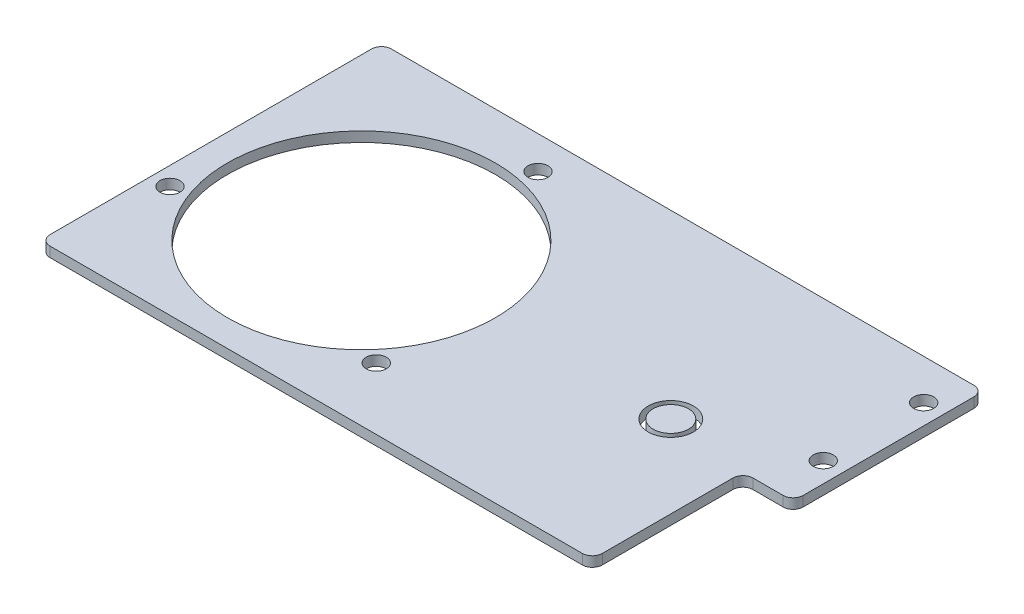
from build123d import *

# Parameters (mm, degrees)
SKETCH1_R           = 84.7725
SKETCH1_R_2         = 6.35
BOSS_EXTRUDE1_DEPTH = 6.35
SKETCH4_R           = 14.2875
SKETCH4_R_2         = 11.176
CUT_EXTRUDE1_DEPTH  = 9.652


with BuildPart() as part:
    # Sketch1 → Boss-Extrude1 (new body)
    with BuildSketch(Plane(origin=(0, 0, 0), x_dir=(1, 0, 0), z_dir=(0, 1, 0))):
        with BuildLine():
            Line((273.05, 114.3), (-95.25, 114.3))
            ThreePointArc((-95.25, 114.3), (-99.740128061, 112.440128061), (-101.6, 107.95))
            Line((-101.6, 107.95), (-101.6, -95.25))
            ThreePointArc((-101.6, -95.25), (-99.740128061, -99.740128061), (-95.25, -101.6))
            Line((-95.25, -101.6), (241.3, -101.6))
            ThreePointArc((241.3, -101.6), (245.790128061, -99.740128061), (247.65, -95.25))
            Line((247.65, -95.25), (247.65, -12.7))
            ThreePointArc((247.65, -12.7), (249.509871939, -8.209871939), (254, -6.35))
            Line((254, -6.35), (273.05, -6.35))
            ThreePointArc((273.05, -6.35), (277.540128061, -4.490128061), (279.4, 0))
            Line((279.4, 0), (279.4, 107.95))
            ThreePointArc((279.4, 107.95), (277.540128061, 112.440128061), (273.05, 114.3))
        make_face()
        with Locations(Location((0, 0, 0), (0, 0, 270))):
            Circle(SKETCH1_R, mode=Mode.SUBTRACT)
        with Locations(Location((-90.060644326, -31.010366712, 0), (0, 0, 270))):
            Circle(SKETCH1_R_2, mode=Mode.SUBTRACT)
        with Locations(Location((18.17455681, 93.499989223, 0), (0, 0, 270))):
            Circle(SKETCH1_R_2, mode=Mode.SUBTRACT)
        with Locations(Location((71.886087516, -62.489622511, 0), (0, 0, 270))):
            Circle(SKETCH1_R_2, mode=Mode.SUBTRACT)
        with Locations(Location((266.7, 88.9, 0), (0, 0, 270))):
            Circle(SKETCH1_R_2, mode=Mode.SUBTRACT)
        with Locations(Location((266.7, 25.4, 0), (0, 0, 270))):
            Circle(SKETCH1_R_2, mode=Mode.SUBTRACT)
    extrude(amount=BOSS_EXTRUDE1_DEPTH)

    # Sketch4 → Cut-Extrude1 (cut)
    with BuildSketch(Plane(origin=(0, 6.35, 0), x_dir=(1, 0, 0), z_dir=(0, 1, 0))):
        with Locations(Location((195.68668, 0, 0), (0, 0, 270))):
            Circle(SKETCH4_R)
        with Locations(Location((195.68668, 0, 0), (0, 0, 270))):
            Circle(SKETCH4_R_2, mode=Mode.SUBTRACT)
    extrude(amount=-CUT_EXTRUDE1_DEPTH, mode=Mode.SUBTRACT)


with BuildPart() as cut_extrude1_piece_1:
    # of the separate pieces the step leaves, piece 1, a body of its own (cut_extrude1_pieces)
    add(part.part.solids().sort_by_distance((273.05, 0, -114.3))[0])


with BuildPart() as cut_extrude1_piece_2:
    # of the separate pieces the step leaves, piece 2, a body of its own (cut_extrude1_pieces)
    add(part.part.solids().sort_by_distance((195.68668, 0, 11.176))[0])


solid = Compound([cut_extrude1_piece_1.part, cut_extrude1_piece_2.part])
